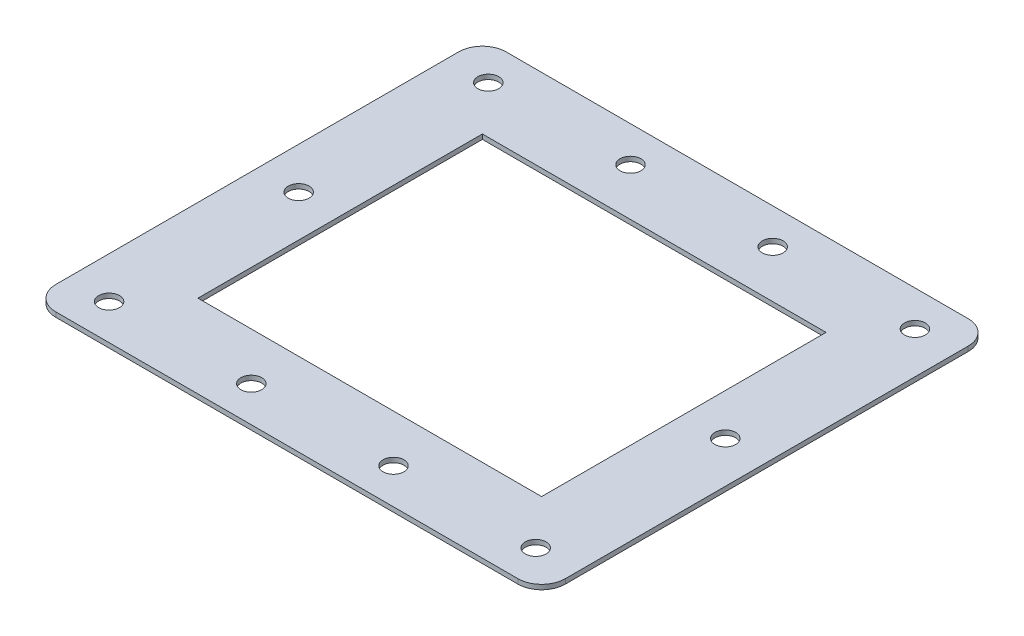
from build123d import *

# Parameters (mm, degrees)
SKETCH_1_W      = 215
SKETCH_1_H      = 190
SKETCH_1_R      = 4.4
SKETCH_1_W_2    = 145
SKETCH_1_H_2    = 120
EXTRUDE_1_DEPTH = 2
FILLET_1_R      = 10


with BuildPart() as part:
    # Эскиз1 → Бобышка-Вытянуть1 (new body)
    with BuildSketch(Plane(origin=(0, 0, 0), x_dir=(1, 0, 0), z_dir=(0, 1, 0))):
        Rectangle(SKETCH_1_W, SKETCH_1_H)
        with Locations(Location((-90, 80, 0), (0, 0, 270))):
            Circle(SKETCH_1_R, mode=Mode.SUBTRACT)
        with Locations(Location((-90, -80, 0), (0, 0, 90))):
            Circle(SKETCH_1_R, mode=Mode.SUBTRACT)
        with Locations(Location((-90, 0, 0), (0, 0, 270))):
            Circle(SKETCH_1_R, mode=Mode.SUBTRACT)
        with Locations(Location((-30, -80, 0), (0, 0, 90))):
            Circle(SKETCH_1_R, mode=Mode.SUBTRACT)
        with Locations(Location((-30, 80, 0), (0, 0, 270))):
            Circle(SKETCH_1_R, mode=Mode.SUBTRACT)
        with Locations(Location((30, -80, 0), (0, 0, 90))):
            Circle(SKETCH_1_R, mode=Mode.SUBTRACT)
        with Locations(Location((30, 80, 0), (0, 0, 270))):
            Circle(SKETCH_1_R, mode=Mode.SUBTRACT)
        with Locations(Location((90, -80, 0), (0, 0, 90))):
            Circle(SKETCH_1_R, mode=Mode.SUBTRACT)
        with Locations(Location((90, 0, 0), (0, 0, 270))):
            Circle(SKETCH_1_R, mode=Mode.SUBTRACT)
        with Locations(Location((90, 80, 0), (0, 0, 270))):
            Circle(SKETCH_1_R, mode=Mode.SUBTRACT)
        Rectangle(SKETCH_1_W_2, SKETCH_1_H_2, mode=Mode.SUBTRACT)
    extrude(amount=EXTRUDE_1_DEPTH)

    # Скругление1
    fillet_1_edges = [part.edges().sort_by_distance(p)[0] for p in [
        (107.5, 1, -95),
        (107.5, 1, 95),
        (-107.5, 1, 95),
        (-107.5, 1, -95),
    ]]
    fillet(fillet_1_edges, radius=FILLET_1_R)


solid = part.part
